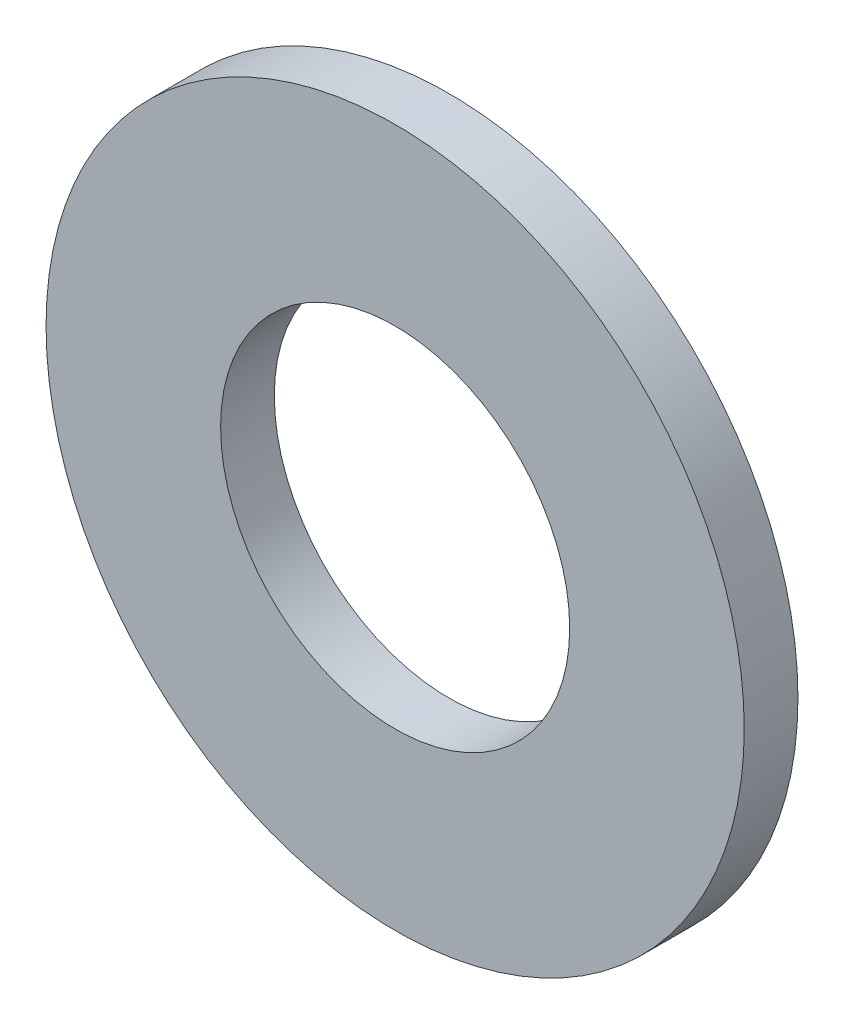
from build123d import *

# Parameters (mm, degrees)
SKETCH_1_R      = 6.5
SKETCH_1_R_2    = 3.25
EXTRUDE_1_DEPTH = 1


with BuildPart() as part:
    # ｽｹｯﾁ1 → ﾎﾞｽ - 押し出し1 (new body)
    with BuildSketch(Plane.XY):
        Circle(SKETCH_1_R)
        Circle(SKETCH_1_R_2, mode=Mode.SUBTRACT)
    extrude(amount=EXTRUDE_1_DEPTH)


solid = part.part
